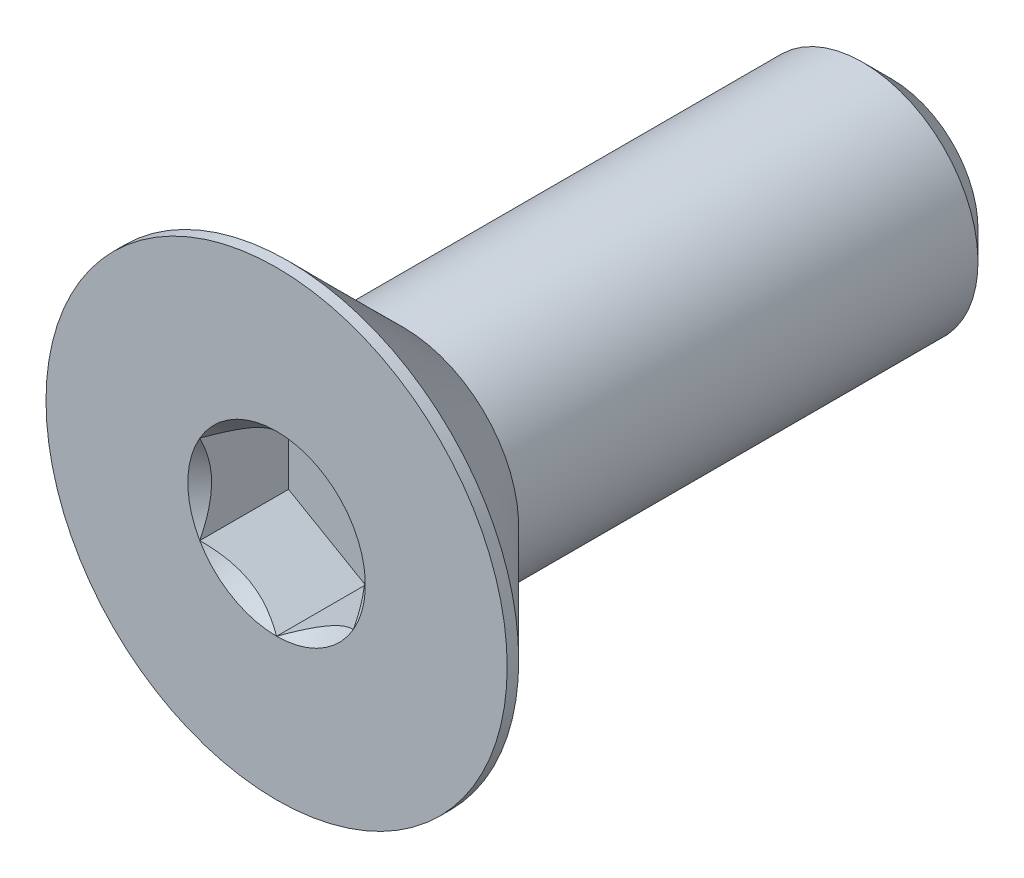
from build123d import *

# Parameters (mm, degrees)
SKETCH1_W          = 16
SKETCH1_H          = 3
CHAMFER1_SIZE      = 0.75
CUT_EXTRUDE2_DEPTH = 2.31


with BuildPart() as part:
    # Sketch1 → Revolve1 (revolve)
    with BuildSketch(Plane(origin=(0, 0, 0), x_dir=(0, 0, -1), z_dir=(1, 0, 0))):
        with Locations((8, 1.5)):
            Rectangle(SKETCH1_W, SKETCH1_H)
    revolve(axis=Axis((0, 0, -16), (0, 0, 1)))

    # Chamfer1
    chamfer1_edges = [part.edges().sort_by_distance(p)[0] for p in [
        (0, -3, -16),
    ]]
    chamfer(chamfer1_edges, length=CHAMFER1_SIZE)

    # Sketch7 → Revolve2 (revolve)
    with BuildSketch(Plane(origin=(0, 0, 0), x_dir=(0, 0, -1), z_dir=(1, 0, 0)), mode=Mode.PRIVATE) as revolve2_sk:
        Polygon((0, 6), (0.3, 6), (3.3, 3), (3.3, 0), (0, 0), align=None)
    revolve(revolve2_sk.sketch.rotate(Axis((0, 0, 0), (0, 0, -1)), 180), axis=Axis((0, 0, 0), (0, 0, -1)))

    # Boss-Extrude1 cone 1 section (through the dimple's axis) → Boss-Extrude1 (revolve)
    with BuildSketch(Plane(origin=(0, 0, -3.3), x_dir=(0, -1, 0), z_dir=(1, 0, 0))):
        Polygon((0, 0), (3, 0), (0, 3), align=None)
    revolve(axis=Axis((0, 0, -3.3), (0, 0, -1)))

    # Sketch5 → Cut-Extrude2 (cut)
    with BuildSketch(Plane.XY):
        Polygon((2, -1.154700538), (2, 1.154700538), (0, 2.309401077), (-2, 1.154700538), (-2, -1.154700538), (0, -2.309401077), align=None)
    extrude(amount=-CUT_EXTRUDE2_DEPTH, mode=Mode.SUBTRACT)

    # Cut-Extrude3 cone 1 section (through the dimple's axis) → Cut-Extrude3 (revolve, cut)
    with BuildSketch(Plane(origin=(0, 0, 0), x_dir=(0, -1, 0), z_dir=(1, 0, 0))):
        Polygon((0, 0), (2.309401077, 0), (0, 2.309401077), align=None)
    revolve(axis=Axis((0, 0, 0), (0, 0, -1)), mode=Mode.SUBTRACT)


solid = part.part
